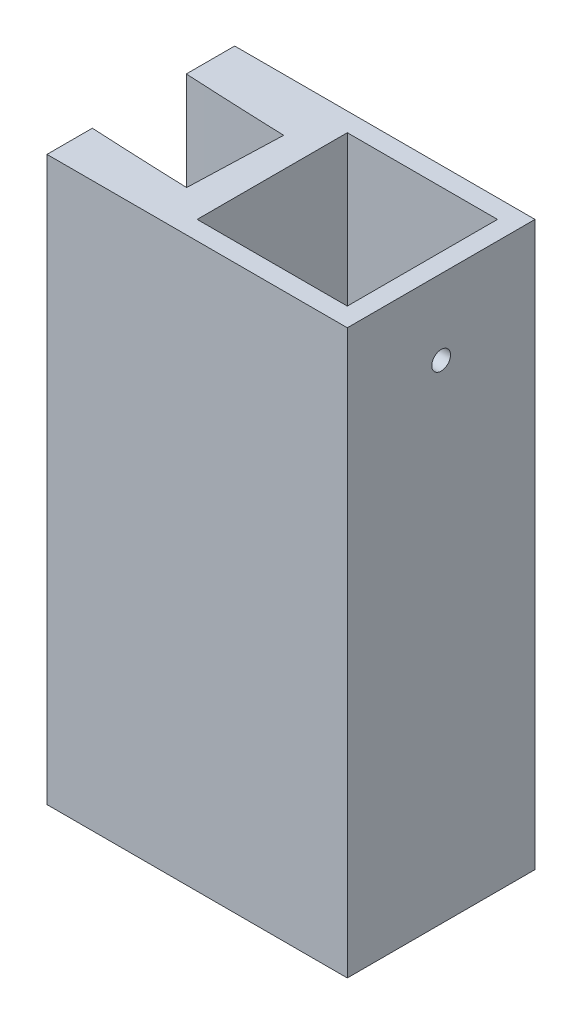
from build123d import *

# Parameters (mm, degrees)
SKETCH_1_W             = 80
SKETCH_1_H             = 50
EXTRUDE_1_DEPTH        = 150
SKETCH_4_W             = 40
SKETCH_4_H             = 40
CUT_EXTRUDE_1_DEPTH    = 40
HOLE_WIZARD_M6_1_D     = 5
HOLE_WIZARD_M6_1_DEPTH = 5
CUT_EXTRUDE_2_REACH    = 163.71


with BuildPart() as part:
    # 草图1 → 凸台-拉伸1 (new body)
    with BuildSketch(Plane(origin=(0, 0, 0), x_dir=(1, 0, 0), z_dir=(0, 1, 0))):
        with Locations((-15, 0)):
            Rectangle(SKETCH_1_W, SKETCH_1_H)
    extrude(amount=EXTRUDE_1_DEPTH)

    # 草图3 → 切除-旋转1 (revolve, cut)
    with BuildSketch(Plane(origin=(0, 0, 0), x_dir=(0, 0, -1), z_dir=(1, 0, 0))):
        Polygon((0, 100), (0, 0), (13.682408883, 0), (13.682408883, 50.759612349), (5, 100), align=None)
    revolve(axis=Axis((0, 0, 0), (0, 1, 0)), mode=Mode.SUBTRACT)

    # 草图4 → 切除-拉伸1 (cut)
    with BuildSketch(Plane(origin=(0, 150, 0), x_dir=(1, 0, 0), z_dir=(0, 1, 0))):
        Rectangle(SKETCH_4_W, SKETCH_4_H)
    extrude(amount=-CUT_EXTRUDE_1_DEPTH, mode=Mode.SUBTRACT)

    # M6 螺纹孔的螺纹孔钻头1
    with Locations(Plane(origin=(25, 0, 0), x_dir=(0, 0, -1), z_dir=(1, 0, 0))):
        with Locations((0, 130)):
            Hole(HOLE_WIZARD_M6_1_D / 2, depth=HOLE_WIZARD_M6_1_DEPTH)

    # 草图8 → 切除-拉伸2 (cut, up to next)
    with BuildSketch(Plane(origin=(0, 150, 0), x_dir=(1, 0, 0), z_dir=(0, 1, 0)), mode=Mode.PRIVATE) as cut_extrude_2_sk1:
        with BuildLine():
            Line((-28.745224922, -14.061873609), (-27.872737504, 10.922897066))
            ThreePointArc((-27.872737504, 10.922897066), (-41.439036623, 11.457514831), (-55, 12.113685699))
            Line((-55, 12.113685699), (-55, -12.920674157))
            ThreePointArc((-55, -12.920674157), (-41.875046777, -13.54727848), (-28.745224922, -14.061873609))
        make_face()
    cut_extrude_2_tool1 = extrude(cut_extrude_2_sk1.sketch, amount=-CUT_EXTRUDE_2_REACH, mode=Mode.PRIVATE) & part.part
    add(cut_extrude_2_tool1.solids().sort_by_distance((-41.655002, 150, 0.95729))[0], mode=Mode.SUBTRACT)


solid = part.part
